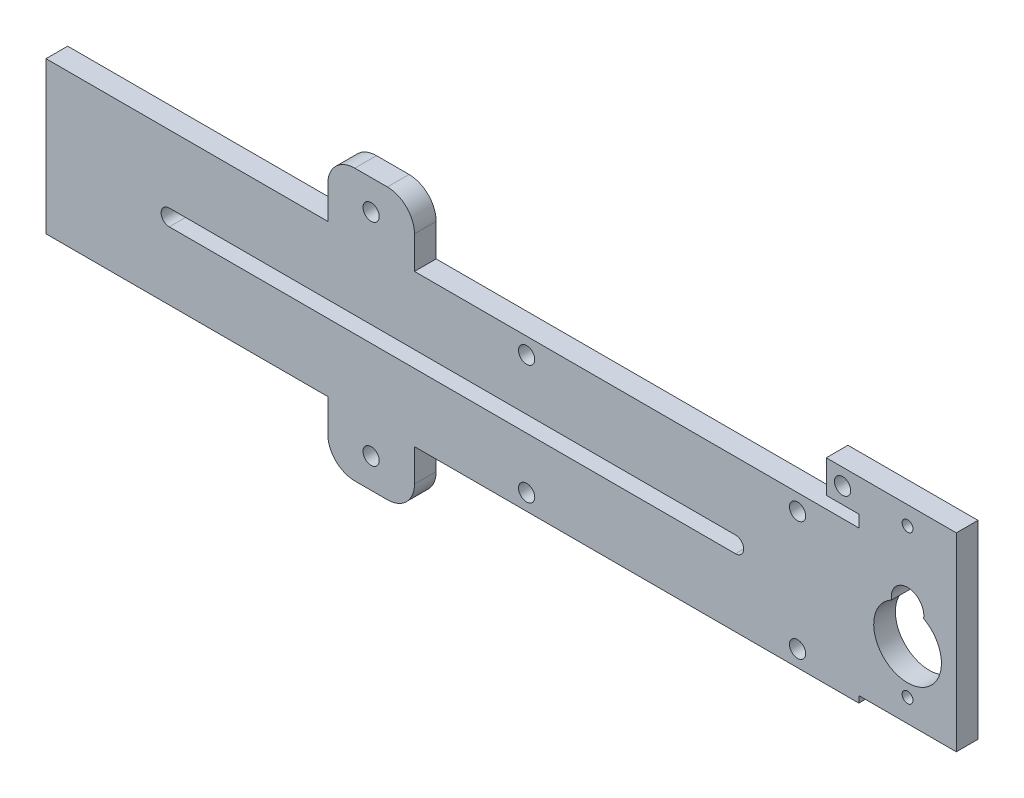
from build123d import *

# Parameters (mm, degrees)
SKETCH_1_W          = 150
SKETCH_1_H          = 28
EXTRUDE_1_DEPTH     = 4
CUT_EXTRUDE_1_DEPTH = 77.40026178
SKETCH_4_R          = 1.5
CUT_EXTRUDE_2_DEPTH = 77.40026178
EXTRUDE_START       = -4
SKETCH_5_W          = 18
SKETCH_5_H          = 35
SKETCH_5_R          = 1
EXTRUDE_3_DEPTH     = 4
SKETCH_7_W          = 6
SKETCH_7_H          = 6
SKETCH_7_R          = 1.5
EXTRUDE_4_DEPTH     = 4
SKETCH_3_W          = 16
SKETCH_3_H          = 10
SKETCH_3_H_2        = 11
SKETCH_3_R          = 1.5
EXTRUDE_2_DEPTH     = 4
FILLET_1_R          = 5


with BuildPart() as part:
    # Эскиз1 → Бобышка-Вытянуть1 (new body)
    with BuildSketch(Plane.XY):
        Rectangle(SKETCH_1_W, SKETCH_1_H)
    extrude(amount=EXTRUDE_1_DEPTH)

    # Эскиз2 → Вырез-Вытянуть1 (cut, through all)
    with BuildSketch(Plane.XY.offset(4)):
        with BuildLine():
            Line((-52.251534571, 1.5), (52.251534571, 1.5))
            ThreePointArc((52.251534571, 1.5), (53.751534571, 0), (52.251534571, -1.5))
            Line((52.251534571, -1.5), (-52.251534571, -1.5))
            ThreePointArc((-52.251534571, -1.5), (-53.751534571, 0), (-52.251534571, 1.5))
        make_face()
    extrude(amount=-CUT_EXTRUDE_1_DEPTH, mode=Mode.SUBTRACT)

    # Эскиз4 → Вырез-Вытянуть2 (cut, through all)
    with BuildSketch(Plane.XY.offset(4)):
        with Locations((13.699103215, -11.003765504)):
            Circle(SKETCH_4_R)
        with Locations((63.699103215, -11.003765504)):
            Circle(SKETCH_4_R)
        with Locations(Location((63.699103215, 11.003765504, 0), (0, 0, 180))):
            Circle(SKETCH_4_R)
        with Locations(Location((13.699103215, 11.003765504, 0), (0, 0, 180))):
            Circle(SKETCH_4_R)
    extrude(amount=-CUT_EXTRUDE_2_DEPTH, mode=Mode.SUBTRACT)

    # Эскиз5 → Бобышка-Вытянуть3 (add)
    with BuildSketch(Plane(origin=(0, 0, 0), x_dir=(-1, 0, 0), z_dir=(0, 0, -1)).offset(EXTRUDE_START)):
        with Locations((-84, 4.714716343)):
            Rectangle(SKETCH_5_W, SKETCH_5_H)
        with Locations((-84, -8.575)):
            Circle(SKETCH_5_R, mode=Mode.SUBTRACT)
        with BuildLine():
            ThreePointArc((-81.041084454, 5.505208333), (-78.635499923, 3.206967246), (-77.75, 0))
            ThreePointArc((-77.75, 0), (-87.206967246, -5.364500077), (-86.958915546, 5.505208333))
            ThreePointArc((-86.958915546, 5.505208333), (-84.248247218, 8.989711243), (-81, 6))
            ThreePointArc((-81, 6), (-81.010288757, 5.751752782), (-81.041084454, 5.505208333))
        make_face(mode=Mode.SUBTRACT)
        with Locations((-84, 18.825)):
            Circle(SKETCH_5_R, mode=Mode.SUBTRACT)
    extrude(amount=EXTRUDE_3_DEPTH)

    # Эскиз7 → Бобышка-Вытянуть4 (add)
    with BuildSketch(Plane.XY.offset(4)):
        with Locations((72, 19.214716343)):
            Rectangle(SKETCH_7_W, SKETCH_7_H)
        with Locations((72, 19.214716343)):
            Circle(SKETCH_7_R, mode=Mode.SUBTRACT)
    extrude(amount=-EXTRUDE_4_DEPTH)

    # Эскиз3 → Бобышка-Вытянуть2 (add)
    # profile 1 of 4: a face of its own
    with BuildSketch(Plane.XY.offset(4)):
        with Locations((-15, 9)):
            Rectangle(SKETCH_3_W, SKETCH_3_H)
    # profile 2 of 4: a face of its own
    with BuildSketch(Plane.XY.offset(4)):
        with Locations((-15, 19.5)):
            Rectangle(SKETCH_3_W, SKETCH_3_H_2)
        with Locations((-15, 19.5)):
            Circle(SKETCH_3_R, mode=Mode.SUBTRACT)
    # profile 3 of 4: a face of its own
    with BuildSketch(Plane.XY.offset(4)):
        with Locations((-15, -9)):
            Rectangle(SKETCH_3_W, SKETCH_3_H)
    # profile 4 of 4: a face of its own
    with BuildSketch(Plane.XY.offset(4)):
        with Locations((-15, -19.5)):
            Rectangle(SKETCH_3_W, SKETCH_3_H_2)
        with Locations((-15, -19.5)):
            Circle(SKETCH_3_R, mode=Mode.SUBTRACT)
    extrude(amount=-EXTRUDE_2_DEPTH)

    # Скругление1
    fillet_1_edges = [part.edges().sort_by_distance(p)[0] for p in [
        (-23, -25, 2),
        (-7, -25, 2),
        (-7, 25, 2),
        (-23, 25, 2),
    ]]
    fillet(fillet_1_edges, radius=FILLET_1_R)


solid = part.part
